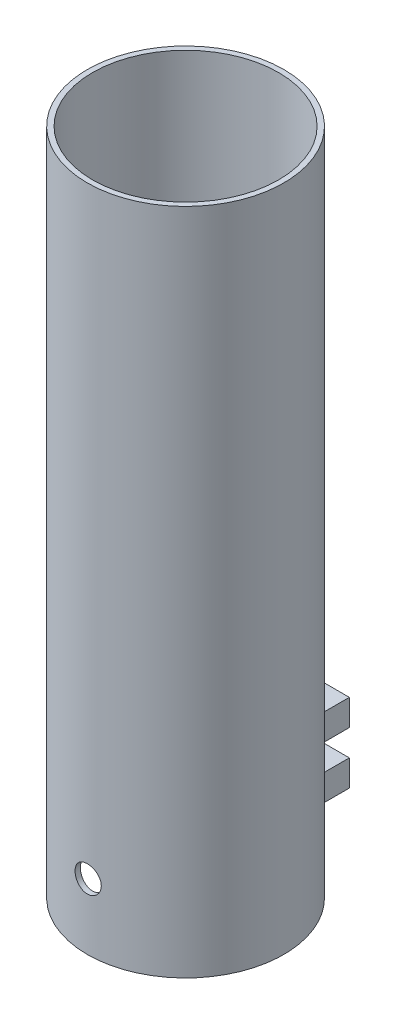
from build123d import *

# Parameters (mm, degrees)
SKETCH1_R               = 37.5
SKETCH1_R_2             = 35.5
BOSS_EXTRUDE1_DEPTH     = 255
CUT_EXTRUDE1_DEPTH      = 261.456330313
CUT_EXTRUDE1_DEPTH_BACK = 261.456330313
SKETCH2_R               = 5
SKETCH3_W               = 10
SKETCH3_H               = 10
BOSS_EXTRUDE2_DEPTH     = 20
BOSS_EXTRUDE2_2_DEPTH   = 20


with BuildPart() as part:
    # Sketch1 → Boss-Extrude1 (new body)
    with BuildSketch(Plane(origin=(0, 0, 0), x_dir=(1, 0, 0), z_dir=(0, 1, 0))):
        with Locations(Location((0, 0, 0), (0, 0, 270))):
            Circle(SKETCH1_R)
        with Locations(Location((0, 0, 0), (0, 0, 270))):
            Circle(SKETCH1_R_2, mode=Mode.SUBTRACT)
    extrude(amount=BOSS_EXTRUDE1_DEPTH)

    # Sketch2 → Cut-Extrude1 (cut, two sides: drawn at the far end of the back side and taken through both)
    with BuildSketch(Plane.XY.offset(-CUT_EXTRUDE1_DEPTH_BACK)):
        with Locations((0, 25)):
            Circle(SKETCH2_R)
    extrude(amount=CUT_EXTRUDE1_DEPTH + CUT_EXTRUDE1_DEPTH_BACK, mode=Mode.SUBTRACT)


with BuildPart() as body_2:
    # Sketch3 → Boss-Extrude2 (new body)
    with BuildSketch(Plane(origin=(0, 0, -37.5), x_dir=(-1, 0, 0), z_dir=(0, 0, -1))):
        with Locations((0, 35)):
            Rectangle(SKETCH3_W, SKETCH3_H)
    extrude(amount=BOSS_EXTRUDE2_DEPTH)


with BuildPart() as body_3:
    # Sketch3 → Boss-Extrude2 2 (new body)
    with BuildSketch(Plane(origin=(0, 0, -37.5), x_dir=(-1, 0, 0), z_dir=(0, 0, -1))):
        with Locations((0, 15)):
            Rectangle(SKETCH3_W, SKETCH3_H)
    extrude(amount=BOSS_EXTRUDE2_2_DEPTH)


solid = Compound([part.part, body_2.part, body_3.part])
